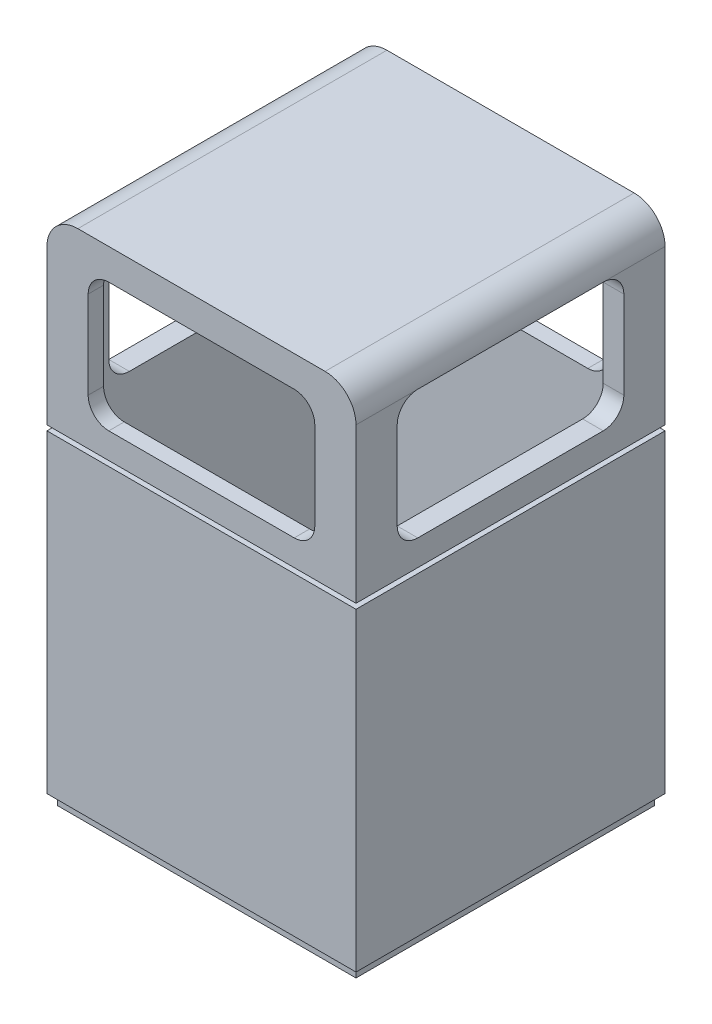
from build123d import *

# Parameters (mm, degrees)
BOSS_EXTRUDE1_DEPTH = 30
CUT_EXTRUDE1_START  = -1.5
CUT_EXTRUDE1_DEPTH  = 27
CUT_EXTRUDE2_DEPTH  = 42.833001327
CUT_EXTRUDE3_DEPTH  = 50.244289009
SKETCH8_W           = 30
SKETCH8_H           = 30
SKETCH8_W_2         = 29
SKETCH8_H_2         = 29
CUT_EXTRUDE5_DEPTH  = 1
CUT_EXTRUDE9_START  = -31
SKETCH9_W           = 30
SKETCH9_H           = 30
SKETCH9_W_2         = 29
SKETCH9_H_2         = 29
CUT_EXTRUDE9_DEPTH  = 0.5


with BuildPart() as part:
    # Sketch1 → Boss-Extrude1 (new body)
    with BuildSketch(Plane.XY):
        with BuildLine():
            Line((-15, -25), (15, -25))
            Line((15, -25), (15, 22))
            ThreePointArc((15, 22), (14.121320344, 24.121320344), (12, 25))
            Line((12, 25), (-12, 25))
            ThreePointArc((-12, 25), (-14.121320344, 24.121320344), (-15, 22))
            Line((-15, 22), (-15, -25))
        make_face()
    extrude(amount=-BOSS_EXTRUDE1_DEPTH)

    # Sketch2 → Cut-Extrude1 (cut)
    with BuildSketch(Plane.XY.offset(CUT_EXTRUDE1_START)):
        with BuildLine():
            Line((-13, 22), (-13, -23))
            Line((-13, -23), (13, -23))
            Line((13, -23), (13, 22))
            ThreePointArc((13, 22), (12.707106781, 22.707106781), (12, 23))
            Line((12, 23), (-12, 23))
            ThreePointArc((-12, 23), (-12.707106781, 22.707106781), (-13, 22))
        make_face()
    extrude(amount=-CUT_EXTRUDE1_DEPTH, mode=Mode.SUBTRACT)

    # Sketch4 → Cut-Extrude2 (cut, through all)
    with BuildSketch(Plane.XY):
        with BuildLine():
            ThreePointArc((-11, 11.5), (-10.414213562, 10.085786438), (-9, 9.5))
            Line((-9, 9.5), (9, 9.5))
            ThreePointArc((9, 9.5), (10.414213562, 10.085786438), (11, 11.5))
            Line((11, 11.5), (11, 20))
            ThreePointArc((11, 20), (10.414213562, 21.414213562), (9, 22))
            Line((9, 22), (-9, 22))
            ThreePointArc((-9, 22), (-10.414213562, 21.414213562), (-11, 20))
            Line((-11, 20), (-11, 11.5))
        make_face()
    extrude(amount=-CUT_EXTRUDE2_DEPTH, mode=Mode.SUBTRACT)

    # Sketch5 → Cut-Extrude3 (cut, through all)
    with BuildSketch(Plane(origin=(15, 0, 0), x_dir=(0, 0, -1), z_dir=(1, 0, 0))):
        with BuildLine():
            Line((6, 22), (24, 22))
            ThreePointArc((24, 22), (25.414213562, 21.414213562), (26, 20))
            Line((26, 20), (26, 11.5))
            ThreePointArc((26, 11.5), (25.414213562, 10.085786438), (24, 9.5))
            Line((24, 9.5), (6, 9.5))
            ThreePointArc((6, 9.5), (4.585786438, 10.085786438), (4, 11.5))
            Line((4, 11.5), (4, 20))
            ThreePointArc((4, 20), (4.585786438, 21.414213562), (6, 22))
        make_face()
    extrude(amount=-CUT_EXTRUDE3_DEPTH, mode=Mode.SUBTRACT)

    # Sketch8 → Cut-Extrude5 (cut)
    with BuildSketch(Plane.XZ.offset(25)):
        with Locations((0, -15)):
            Rectangle(SKETCH8_W, SKETCH8_H)
        with Locations((0, -15)):
            Rectangle(SKETCH8_W_2, SKETCH8_H_2, mode=Mode.SUBTRACT)
    extrude(amount=-CUT_EXTRUDE5_DEPTH, mode=Mode.SUBTRACT)

    # Sketch9 → Cut-Extrude9 (cut)
    with BuildSketch(Plane.XZ.offset(24).offset(CUT_EXTRUDE9_START)):
        with Locations((0, -15)):
            Rectangle(SKETCH9_W, SKETCH9_H)
        with Locations((0, -15)):
            Rectangle(SKETCH9_W_2, SKETCH9_H_2, mode=Mode.SUBTRACT)
    extrude(amount=CUT_EXTRUDE9_DEPTH, mode=Mode.SUBTRACT)


solid = part.part
